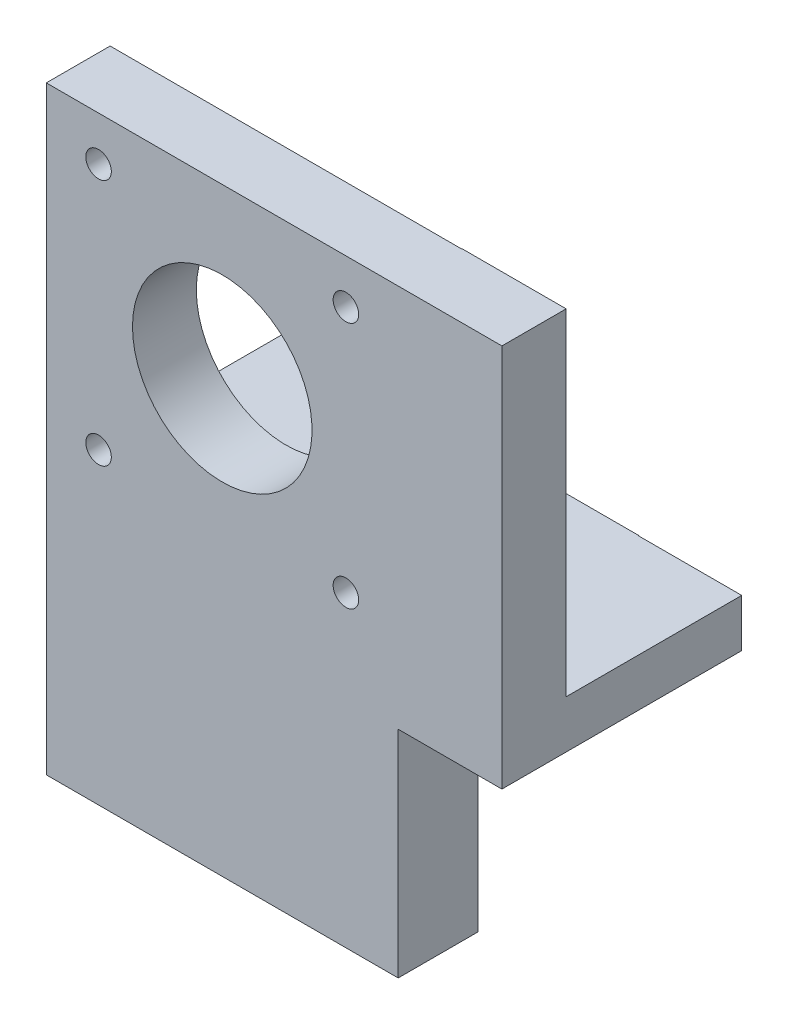
from build123d import *

# Parameters (mm, degrees)
SKETCH3_W                                       = 44.1
SKETCH3_H                                       = 30.1
BOSS_EXTRUDE1_DEPTH                             = 8
SKETCH4_W                                       = 44.1
SKETCH4_H                                       = 10
BOSS_EXTRUDE2_DEPTH                             = 25
CSK_FOR_M3_FLAT_HEAD_MACHINE_SCREW1_D           = 3.2
CSK_FOR_M3_FLAT_HEAD_MACHINE_SCREW1_CSINK_D     = 6.3
CSK_FOR_M3_FLAT_HEAD_MACHINE_SCREW1_CSINK_ANGLE = 90
SKETCH10_W                                      = 44.1
SKETCH10_H                                      = 8
BOSS_EXTRUDE3_DEPTH                             = 42.1
SKETCH11_R                                      = 11.25
CUT_EXTRUDE1_DEPTH                              = 42
M3_CLEARANCE_HOLE4_D                            = 3.2
BOSS_EXTRUDE4_DEPTH                             = 13
CHAMFER2_SIZE                                   = 2


with BuildPart() as part:
    # Sketch3 → Boss-Extrude1 (new body)
    with BuildSketch(Plane(origin=(0, 0, 0), x_dir=(1, 0, 0), z_dir=(0, 1, 0))):
        with Locations((0, -5)):
            Rectangle(SKETCH3_W, SKETCH3_H)
    extrude(amount=-BOSS_EXTRUDE1_DEPTH)

    # Sketch4 → Boss-Extrude2 (add)
    with BuildSketch(Plane.XZ.offset(8)):
        with Locations((0, 15.05)):
            Rectangle(SKETCH4_W, SKETCH4_H)
    extrude(amount=BOSS_EXTRUDE2_DEPTH)

    # CSK for M3 Flat Head Machine Screw1 (through all)
    with Locations(Plane(origin=(0, 0, 0), x_dir=(1, 0, 0), z_dir=(0, 1, 0))):
        with Locations((8, -7.5), (-8, -7.5), (8, 7.5), (-8, 7.5)):
            CounterSinkHole(CSK_FOR_M3_FLAT_HEAD_MACHINE_SCREW1_D / 2, CSK_FOR_M3_FLAT_HEAD_MACHINE_SCREW1_CSINK_D / 2, counter_sink_angle=CSK_FOR_M3_FLAT_HEAD_MACHINE_SCREW1_CSINK_ANGLE)

    # Sketch10 → Boss-Extrude3 (add)
    with BuildSketch(Plane(origin=(0, 0, 0), x_dir=(1, 0, 0), z_dir=(0, 1, 0))):
        with Locations((0, -16.05)):
            Rectangle(SKETCH10_W, SKETCH10_H)
    extrude(amount=BOSS_EXTRUDE3_DEPTH)

    # Sketch11 → Cut-Extrude1 (cut)
    with BuildSketch(Plane(origin=(0, 0, 12.05), x_dir=(-1, 0, 0), z_dir=(0, 0, -1))):
        with Locations((0, 21.05)):
            Circle(SKETCH11_R)
    extrude(amount=-CUT_EXTRUDE1_DEPTH, mode=Mode.SUBTRACT)

    # M3 Clearance Hole4 (through all)
    with Locations(Plane(origin=(0, 0, 12.05), x_dir=(-1, 0, 0), z_dir=(0, 0, -1))):
        with Locations((15.5, 5.55), (-15.5, 5.55), (15.5, 36.55), (-15.5, 36.55)):
            Hole(M3_CLEARANCE_HOLE4_D / 2)

    # Sketch14 → Boss-Extrude4 (add)
    with BuildSketch(Plane(origin=(22.05, 0, 0), x_dir=(0, 0, -1), z_dir=(1, 0, 0))):
        Polygon((10, 0), (-10, 0), (-12, 0), (-12, 42.1), (-20.05, 42.1), (-20.05, -6), (-12, -6), (-10, -6), (10, -6), align=None)
    extrude(amount=BOSS_EXTRUDE4_DEPTH)

    # Chamfer2
    chamfer2_edges = [part.edges().sort_by_distance(p)[0] for p in [
        (-22.05, -8, 0),
    ]]
    chamfer(chamfer2_edges, length=CHAMFER2_SIZE)


solid = part.part
